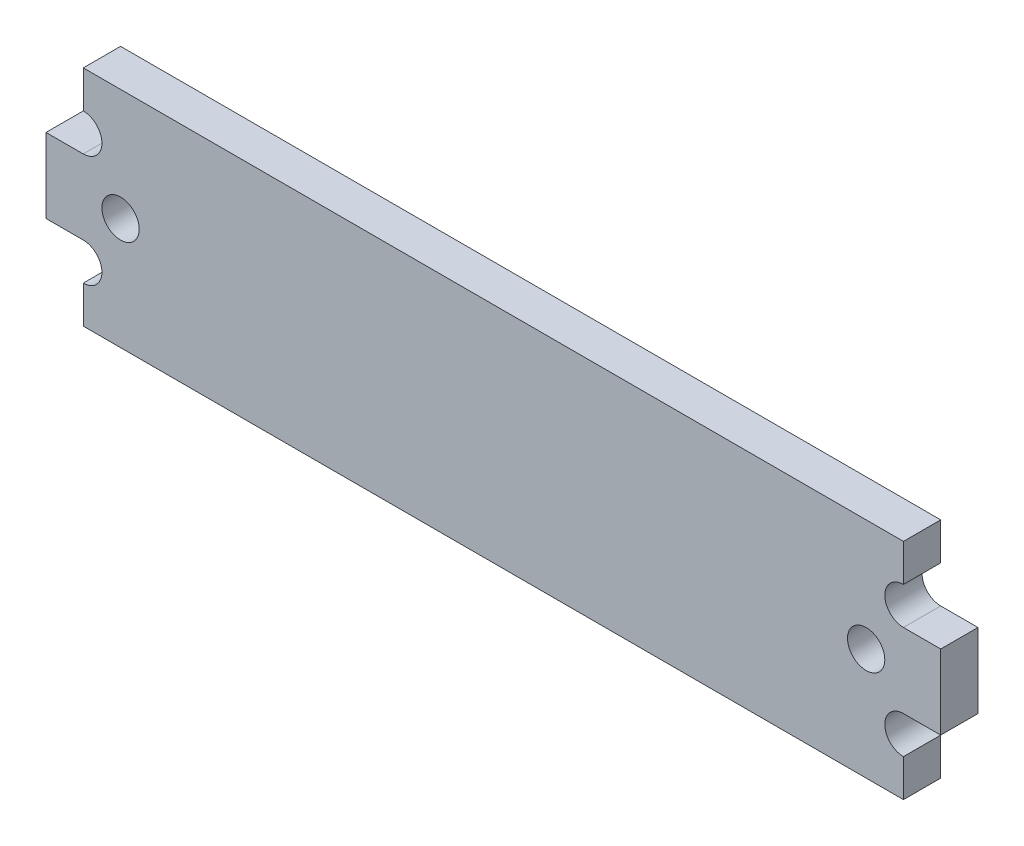
from build123d import *

# Parameters (mm, degrees)
SKETCH_1_R      = 1
EXTRUDE_1_DEPTH = 2


with BuildPart() as part:
    # 草圖1 → 填料-伸長1 (new body)
    with BuildSketch(Plane.XY):
        with BuildLine():
            Line((-31.390669594, -5.425), (-31.390669594, -7.425))
            Line((-31.390669594, -7.425), (12.609330406, -7.425))
            Line((12.609330406, -7.425), (12.609330406, -5.425))
            ThreePointArc((12.609330406, -5.425), (11.609330406, -4.425), (12.609330406, -3.425))
            Line((12.609330406, -3.425), (14.609330406, -3.425))
            Line((14.609330406, -3.425), (14.609330406, 0.575))
            Line((14.609330406, 0.575), (12.609330406, 0.575))
            ThreePointArc((12.609330406, 0.575), (11.609330406, 1.575), (12.609330406, 2.575))
            Line((12.609330406, 2.575), (12.609330406, 4.575))
            Line((12.609330406, 4.575), (-31.390669594, 4.575))
            Line((-31.390669594, 4.575), (-31.390669594, 2.575))
            ThreePointArc((-31.390669594, 2.575), (-30.390669594, 1.575), (-31.390669594, 0.575))
            Line((-31.390669594, 0.575), (-33.390669594, 0.575))
            Line((-33.390669594, 0.575), (-33.390669594, -3.425))
            Line((-33.390669594, -3.425), (-31.390669594, -3.425))
            ThreePointArc((-31.390669594, -3.425), (-30.390669594, -4.425), (-31.390669594, -5.425))
        make_face()
        with Locations((-29.390669594, -1.425)):
            Circle(SKETCH_1_R, mode=Mode.SUBTRACT)
        with Locations((10.609330406, -1.425)):
            Circle(SKETCH_1_R, mode=Mode.SUBTRACT)
    extrude(amount=EXTRUDE_1_DEPTH)


solid = part.part
